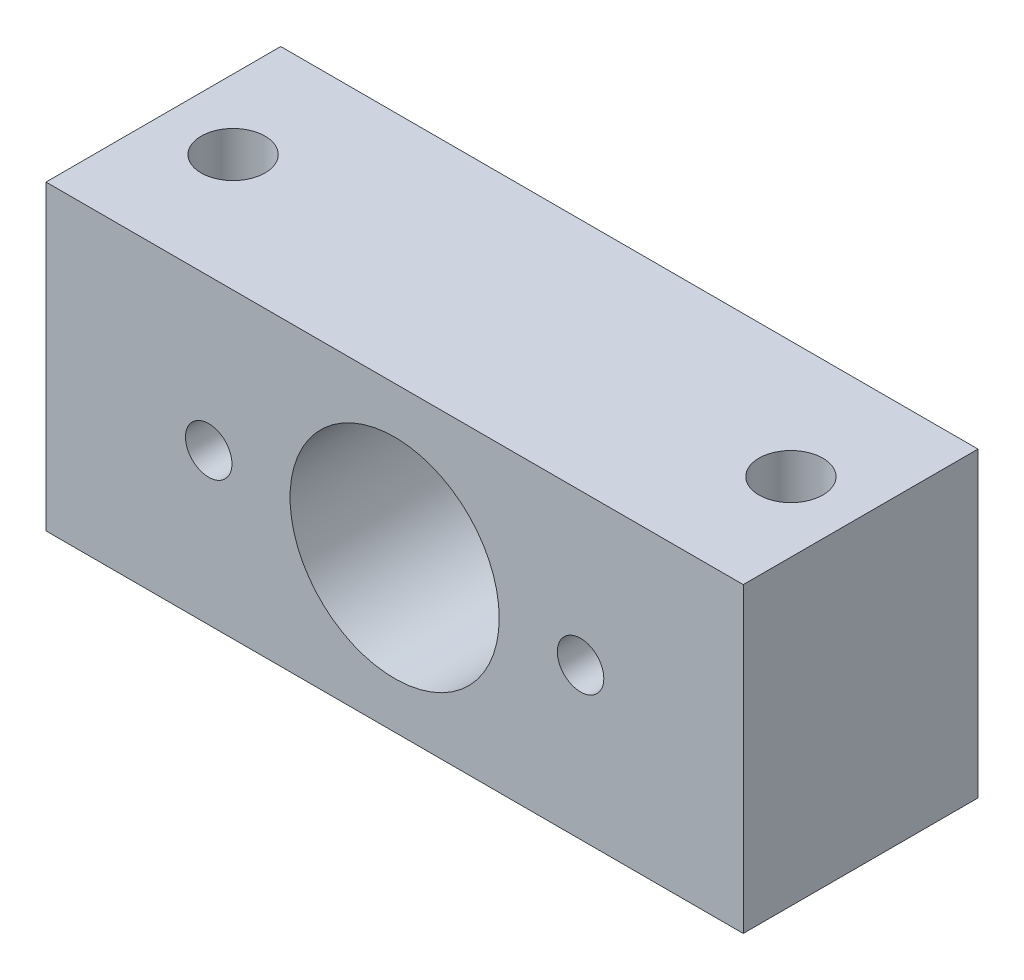
from build123d import *

# Parameters (mm, degrees)
SKETCH1_W                      = 60
SKETCH1_H                      = 26
BOSS_EXTRUDE1_DEPTH            = 20.2
SKETCH2_R                      = 9
SKETCH2_R_2                    = 2
CUT_EXTRUDE1_DEPTH             = 69.440046756
SKETCH3_R                      = 11.5
CUT_EXTRUDE2_DEPTH             = 4
F_5_5_5_5_DIAMETER_HOLE1_D     = 5.5
F_5_5_5_5_DIAMETER_HOLE1_DEPTH = 30
F_5_5_5_5_DIAMETER_HOLE1_TIP   = 1.652366702


with BuildPart() as part:
    # Sketch1 → Boss-Extrude1 (new body)
    with BuildSketch(Plane.XY):
        with Locations((30, 13)):
            Rectangle(SKETCH1_W, SKETCH1_H)
    extrude(amount=BOSS_EXTRUDE1_DEPTH)

    # Sketch2 → Cut-Extrude1 (cut, through all)
    with BuildSketch(Plane.XY.offset(20.2)):
        with Locations((30, 13)):
            Circle(SKETCH2_R)
        with Locations((14, 13)):
            Circle(SKETCH2_R_2)
        with Locations((46, 13)):
            Circle(SKETCH2_R_2)
    extrude(amount=-CUT_EXTRUDE1_DEPTH, mode=Mode.SUBTRACT)

    # Sketch3 → Cut-Extrude2 (cut)
    with BuildSketch(Plane(origin=(0, 0, 0), x_dir=(-1, 0, 0), z_dir=(0, 0, -1))):
        with Locations((-30, 13)):
            Circle(SKETCH3_R)
    extrude(amount=-CUT_EXTRUDE2_DEPTH, mode=Mode.SUBTRACT)

    # Ø5.5 (5.5) Diameter Hole1
    with Locations(Plane(origin=(0, 26, 0), x_dir=(-1, 0, 0), z_dir=(0, 1, 0))):
        with Locations((-6, 10.1), (-54, 10.1)):
            Hole(F_5_5_5_5_DIAMETER_HOLE1_D / 2, depth=F_5_5_5_5_DIAMETER_HOLE1_DEPTH)
            with Locations((0, 0, -(F_5_5_5_5_DIAMETER_HOLE1_DEPTH + F_5_5_5_5_DIAMETER_HOLE1_TIP / 2))):  # 118° drill point
                Cone(0, F_5_5_5_5_DIAMETER_HOLE1_D / 2, F_5_5_5_5_DIAMETER_HOLE1_TIP, mode=Mode.SUBTRACT)


solid = part.part
